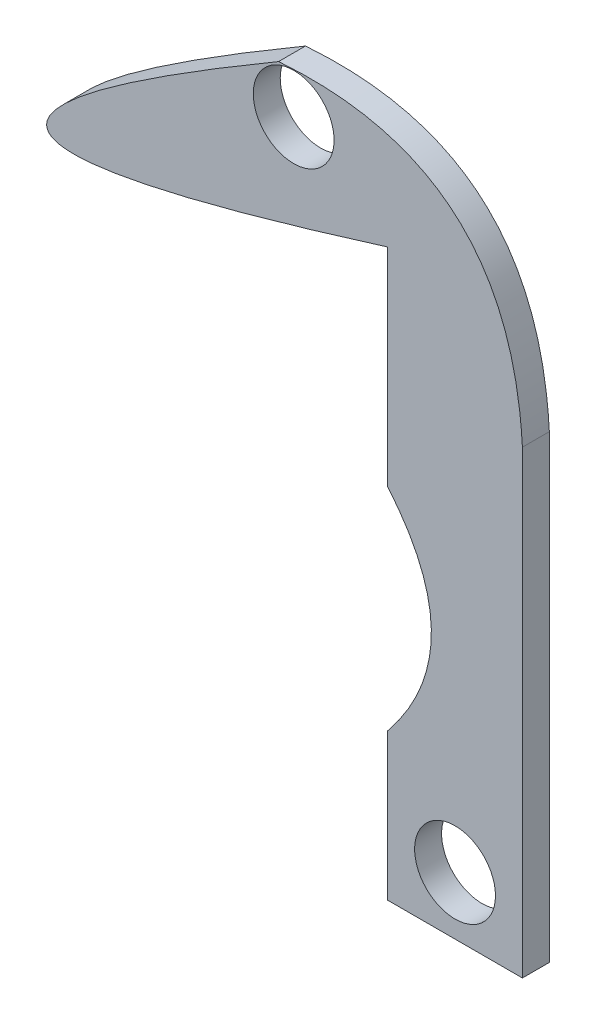
from build123d import *

# Parameters (mm, degrees)
BOSS_EXTRU_1_DEPTH      = 2
ESQUISSE2_R             = 3
ENL_V_MAT_EXTRU_1_DEPTH = 2
ENL_V_MAT_EXTRU_2_DEPTH = 10
ENL_V_MAT_EXTRU_3_DEPTH = 10
ESQUISSE5_R             = 3
ENL_V_MAT_EXTRU_4_DEPTH = 10


with BuildPart() as part:
    # Esquisse1 → Boss.-Extru.1 (new body)
    with BuildSketch(Plane.XY):
        with BuildLine():
            Line((0, 0), (10, 0))
            Line((10, 0), (10, 18))
            Line((10, 18), (10, 60))
            add(Edge.make_bspline(
                [(10, 60), (-55.226480478, 24.725568105), (0, 42)],
                knots=[0, 0, 0, 1, 1, 1], degree=2))
            Line((0, 42), (0, 0))
        make_face()
    extrude(amount=BOSS_EXTRU_1_DEPTH)

    # Esquisse2 → Enlèv. mat.-Extru.1 (cut)
    with BuildSketch(Plane.XY.offset(2)):
        with Locations((5, 4.288504874)):
            Circle(ESQUISSE2_R)
    extrude(amount=-ENL_V_MAT_EXTRU_1_DEPTH, mode=Mode.SUBTRACT)

    # Esquisse3 → Enlèv. mat.-Extru.2 (cut)
    with BuildSketch(Plane.XY.offset(2)):
        with BuildLine():
            Line((0, 26.586944004), (0, 10.895604928))
            add(Edge.make_bspline(
                [(0, 26.586944004), (6.480930753, 18.900406898), (0, 10.895604928)],
                knots=[0, 0, 0, 1, 1, 1], degree=2))
        make_face()
    extrude(amount=-ENL_V_MAT_EXTRU_2_DEPTH, mode=Mode.SUBTRACT)

    # Esquisse4 → Enlèv. mat.-Extru.3 (cut)
    with BuildSketch(Plane.XY.offset(2)):
        with BuildLine():
            Line((10, 34.129750272), (10, 60))
            add(Edge.make_bspline(
                [(10, 60), (-0.661573878, 54.234228815), (-8.10495368, 49.872428448)],
                knots=[0, 0, 0, 1, 1, 1], degree=2))
            add(Edge.make_bspline(
                [(10, 34.129750272), (9.070365691, 51.175646323), (-8.10495368, 49.872428448)],
                knots=[0, 0, 0, 1, 1, 1], degree=2))
        make_face()
    extrude(amount=-ENL_V_MAT_EXTRU_3_DEPTH, mode=Mode.SUBTRACT)

    # Esquisse5 → Enlèv. mat.-Extru.4 (cut)
    with BuildSketch(Plane(origin=(0, 0, 0), x_dir=(-1, 0, 0), z_dir=(0, 0, -1))):
        with Locations((6.979598084, 46.87242842)):
            Circle(ESQUISSE5_R)
    extrude(amount=-ENL_V_MAT_EXTRU_4_DEPTH, mode=Mode.SUBTRACT)


solid = part.part
